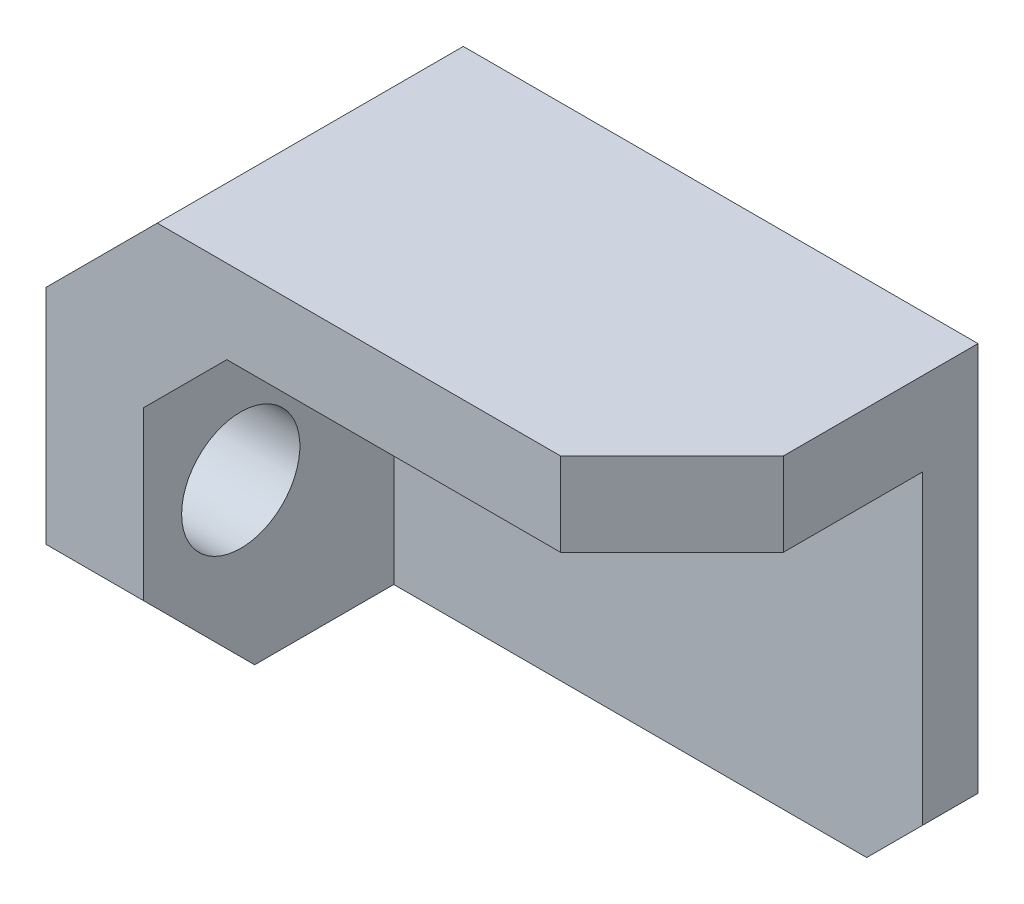
from build123d import *

# Parameters (mm, degrees)
ESQUISSE1_W                  = 45
ESQUISSE1_H                  = 32
BOSS_EXTRU_1_DEPTH           = 22
ESQUISSE2_R                  = 5.25
ENL_V_MAT_EXTRU_1_DEPTH      = 60.439044407
ENL_V_MAT_EXTRU_2_DEPTH      = 60.439044407
ENL_V_MAT_EXTRU_2_DEPTH_BACK = 60.439044407
ESQUISSE3_R                  = 4.25
ESQUISSE4_W                  = 18
ESQUISSE4_H                  = 26
ENL_V_MAT_EXTRU_3_DEPTH      = 38
CHANFREIN1_SIZE              = 8
BOSS_EXTRU_2_DEPTH           = 18
CHANFREIN2_SIZE              = 4


with BuildPart() as part:
    # Esquisse1 → Boss.-Extru.1 (new body)
    with BuildSketch(Plane.XY):
        with Locations((22.5, 16)):
            Rectangle(ESQUISSE1_W, ESQUISSE1_H)
    extrude(amount=BOSS_EXTRU_1_DEPTH)

    # Esquisse2 → Enlèv. mat.-Extru.1 (cut, through all)
    with BuildSketch(Plane.XY.offset(22)):
        with Locations((22.5, 16)):
            Circle(ESQUISSE2_R)
    extrude(amount=-ENL_V_MAT_EXTRU_1_DEPTH, mode=Mode.SUBTRACT)

    # Esquisse3 → Enlèv. mat.-Extru.2 (cut, two sides: drawn at the far end of the back side and taken through both)
    with BuildSketch(Plane.ZY.offset(-ENL_V_MAT_EXTRU_2_DEPTH_BACK)):
        with Locations((15, 12)):
            Circle(ESQUISSE3_R)
    extrude(amount=ENL_V_MAT_EXTRU_2_DEPTH + ENL_V_MAT_EXTRU_2_DEPTH_BACK, mode=Mode.SUBTRACT)

    # Esquisse4 → Enlèv. mat.-Extru.3 (cut)
    with BuildSketch(Plane(origin=(45, 0, 0), x_dir=(0, 0, -1), z_dir=(1, 0, 0))):
        with Locations((-13, 13)):
            Rectangle(ESQUISSE4_W, ESQUISSE4_H)
    extrude(amount=-ENL_V_MAT_EXTRU_3_DEPTH, mode=Mode.SUBTRACT)

    # Chanfrein1
    chanfrein1_edges = [part.edges().sort_by_distance(p)[0] for p in [
        (45, 29, 22),
        (3.5, 0, 22),
        (0, 32, 11),
    ]]
    chamfer(chanfrein1_edges, length=CHANFREIN1_SIZE)

    # Esquisse7 → Boss.-Extru.2 (add)
    with BuildSketch(Plane.XY.offset(22)):
        Polygon((7, 26), (13, 26), (7, 20), align=None)
    extrude(amount=-BOSS_EXTRU_2_DEPTH)

    # Chanfrein2
    chanfrein2_edges = [part.edges().sort_by_distance(p)[0] for p in [
        (45, 0, 2),
    ]]
    chamfer(chanfrein2_edges, length=CHANFREIN2_SIZE)


solid = part.part
